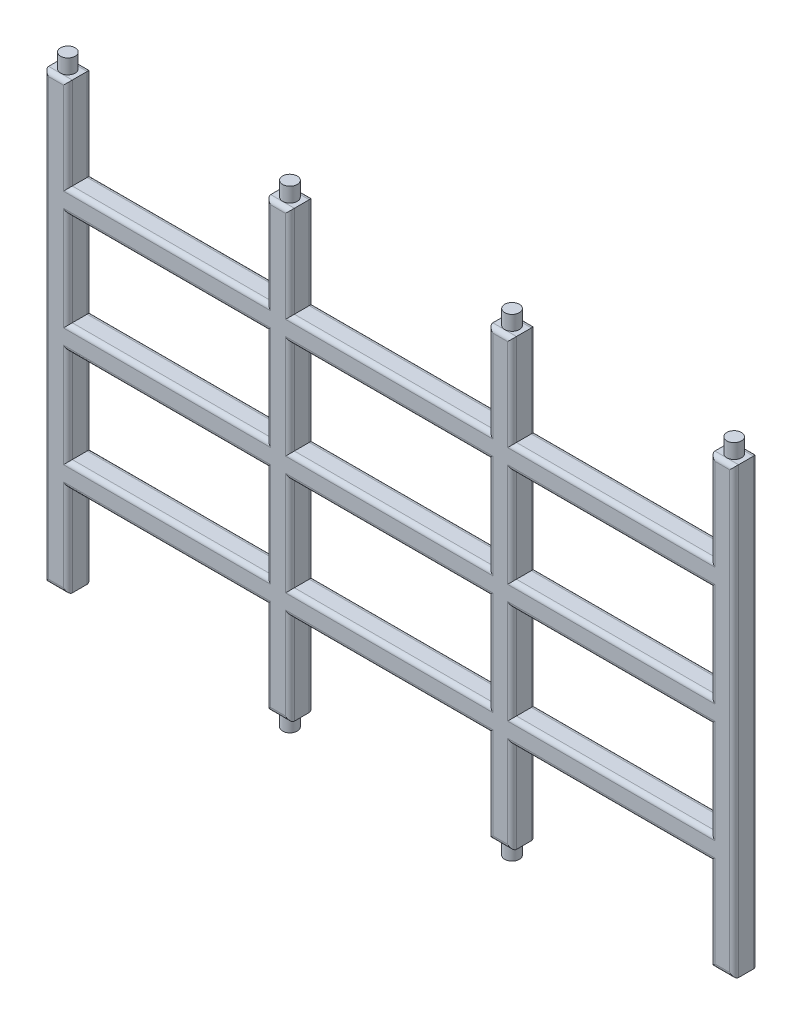
from build123d import *

# Parameters (mm, degrees)
SKETCH_1_W          = 8
SKETCH_1_H          = 31
SKETCH_1_W_2        = 67
SKETCH_1_H_2        = 8
SKETCH_1_H_3        = 32
EXTRUDE_1_DEPTH     = 8
SKETCH_2_R          = 2.475
EXTRUDE_3_DEPTH     = 4.95
EXTRUDE_START       = 4.95
SKETCH_3_R          = 2.475
EXTRUDE_4_DEPTH     = 4.95
SKETCH_4_R          = 2.525
CUT_EXTRUDE_1_DEPTH = 15
FILLET_3_R          = 1.5


with BuildPart() as part:
    # 草图1 → 凸台-拉伸1 (new body)
    with BuildSketch(Plane.XY):
        with Locations((4, 134.5)):
            Rectangle(SKETCH_1_W, SKETCH_1_H)
        with Locations((41.5, 115)):
            Rectangle(SKETCH_1_W_2, SKETCH_1_H_2)
        with Locations((4, 115)):
            Rectangle(SKETCH_1_W, SKETCH_1_H_2)
        with Locations((4, 95)):
            Rectangle(SKETCH_1_W, SKETCH_1_H_3)
        with Locations((41.5, 75)):
            Rectangle(SKETCH_1_W_2, SKETCH_1_H_2)
        with Locations((4, 55)):
            Rectangle(SKETCH_1_W, SKETCH_1_H_3)
        with Locations((4, 75)):
            Rectangle(SKETCH_1_W, SKETCH_1_H_2)
        with Locations((4, 35)):
            Rectangle(SKETCH_1_W, SKETCH_1_H_2)
        with Locations((4, 15.5)):
            Rectangle(SKETCH_1_W, SKETCH_1_H)
        with Locations((41.5, 35)):
            Rectangle(SKETCH_1_W_2, SKETCH_1_H_2)
        with Locations((79, 35)):
            Rectangle(SKETCH_1_W, SKETCH_1_H_2)
        with Locations((79, 15.5)):
            Rectangle(SKETCH_1_W, SKETCH_1_H)
        with Locations((79, 55)):
            Rectangle(SKETCH_1_W, SKETCH_1_H_3)
        with Locations((79, 75)):
            Rectangle(SKETCH_1_W, SKETCH_1_H_2)
        with Locations((79, 95)):
            Rectangle(SKETCH_1_W, SKETCH_1_H_3)
        with Locations((79, 115)):
            Rectangle(SKETCH_1_W, SKETCH_1_H_2)
        with Locations((79, 134.5)):
            Rectangle(SKETCH_1_W, SKETCH_1_H)
        with Locations((116.5, 115)):
            Rectangle(SKETCH_1_W_2, SKETCH_1_H_2)
        with Locations((116.5, 75)):
            Rectangle(SKETCH_1_W_2, SKETCH_1_H_2)
        with Locations((116.5, 35)):
            Rectangle(SKETCH_1_W_2, SKETCH_1_H_2)
        with Locations((154, 15.5)):
            Rectangle(SKETCH_1_W, SKETCH_1_H)
        with Locations((154, 35)):
            Rectangle(SKETCH_1_W, SKETCH_1_H_2)
        with Locations((154, 55)):
            Rectangle(SKETCH_1_W, SKETCH_1_H_3)
        with Locations((154, 75)):
            Rectangle(SKETCH_1_W, SKETCH_1_H_2)
        with Locations((154, 95)):
            Rectangle(SKETCH_1_W, SKETCH_1_H_3)
        with Locations((154, 115)):
            Rectangle(SKETCH_1_W, SKETCH_1_H_2)
        with Locations((154, 134.5)):
            Rectangle(SKETCH_1_W, SKETCH_1_H)
        with Locations((191.5, 115)):
            Rectangle(SKETCH_1_W_2, SKETCH_1_H_2)
        with Locations((191.5, 75)):
            Rectangle(SKETCH_1_W_2, SKETCH_1_H_2)
        with Locations((191.5, 35)):
            Rectangle(SKETCH_1_W_2, SKETCH_1_H_2)
        with Locations((229, 15.5)):
            Rectangle(SKETCH_1_W, SKETCH_1_H)
        with Locations((229, 35)):
            Rectangle(SKETCH_1_W, SKETCH_1_H_2)
        with Locations((229, 55)):
            Rectangle(SKETCH_1_W, SKETCH_1_H_3)
        with Locations((229, 75)):
            Rectangle(SKETCH_1_W, SKETCH_1_H_2)
        with Locations((229, 95)):
            Rectangle(SKETCH_1_W, SKETCH_1_H_3)
        with Locations((229, 115)):
            Rectangle(SKETCH_1_W, SKETCH_1_H_2)
        with Locations((229, 134.5)):
            Rectangle(SKETCH_1_W, SKETCH_1_H)
    extrude(amount=EXTRUDE_1_DEPTH)

    # 草图2 → 凸台-拉伸3 (add)
    with BuildSketch(Plane(origin=(0, 150, 0), x_dir=(1, 0, 0), z_dir=(0, 1, 0))):
        with Locations((4, -4)):
            Circle(SKETCH_2_R)
        with Locations((229, -4)):
            Circle(SKETCH_2_R)
        with Locations((79, -4)):
            Circle(SKETCH_2_R)
        with Locations((154, -4)):
            Circle(SKETCH_2_R)
    extrude(amount=EXTRUDE_3_DEPTH)

    # 草图3 → 凸台-拉伸4 (add)
    with BuildSketch(Plane.XZ.offset(EXTRUDE_START)):
        with Locations((79, 4)):
            Circle(SKETCH_3_R)
        with Locations((154, 4)):
            Circle(SKETCH_3_R)
    extrude(amount=-EXTRUDE_4_DEPTH)

    # 草图4 → 切除-拉伸1 (cut)
    with BuildSketch(Plane.XZ):
        with Locations(Location((4, 4, 0), (0, 0, 270))):
            Circle(SKETCH_4_R)
        with Locations(Location((229, 4, 0), (0, 0, 270))):
            Circle(SKETCH_4_R)
    extrude(amount=-CUT_EXTRUDE_1_DEPTH, mode=Mode.SUBTRACT)

    # 圆角3
    fillet_3_edges = [part.edges().sort_by_distance(p)[0] for p in [
        (4, 150, 8),
        (0, 75, 8),
        (191.5, 31, 8),
        (4, 0, 8),
        (8, 15.5, 8),
        (41.5, 31, 8),
        (75, 15.5, 8),
        (79, 0, 8),
        (83, 15.5, 8),
        (116.5, 31, 8),
        (150, 15.5, 8),
        (154, 0, 8),
        (225, 15.5, 8),
        (158, 15.5, 8),
        (225, 55, 8),
        (191.5, 39, 8),
        (158, 55, 8),
        (191.5, 71, 8),
        (150, 55, 8),
        (116.5, 39, 8),
        (83, 55, 8),
        (116.5, 71, 8),
        (225, 95, 8),
        (229, 0, 8),
        (191.5, 79, 8),
        (158, 95, 8),
        (191.5, 111, 8),
        (75, 55, 8),
        (41.5, 39, 8),
        (8, 55, 8),
        (41.5, 71, 8),
        (150, 95, 8),
        (116.5, 79, 8),
        (83, 95, 8),
        (233, 75, 8),
        (116.5, 111, 8),
        (75, 95, 8),
        (41.5, 79, 8),
        (8, 95, 8),
        (41.5, 111, 8),
        (229, 150, 8),
        (225, 134.5, 8),
        (191.5, 119, 8),
        (158, 134.5, 8),
        (41.5, 111, 0),
        (8, 95, 0),
        (41.5, 79, 0),
        (75, 95, 0),
        (154, 150, 8),
        (116.5, 111, 0),
        (83, 95, 0),
        (116.5, 79, 0),
        (150, 95, 0),
        (41.5, 71, 0),
        (8, 55, 0),
        (41.5, 39, 0),
        (75, 55, 0),
        (191.5, 111, 0),
        (158, 95, 0),
        (150, 134.5, 8),
        (191.5, 79, 0),
        (225, 95, 0),
        (116.5, 71, 0),
        (83, 55, 0),
        (116.5, 39, 0),
        (150, 55, 0),
        (191.5, 71, 0),
        (158, 55, 0),
        (191.5, 39, 0),
        (225, 55, 0),
        (116.5, 119, 8),
        (158, 15.5, 0),
        (154, 0, 0),
        (150, 15.5, 0),
        (116.5, 31, 0),
        (83, 15.5, 0),
        (79, 0, 0),
        (75, 15.5, 0),
        (41.5, 31, 0),
        (8, 15.5, 0),
        (4, 0, 0),
        (83, 134.5, 8),
        (0, 75, 0),
        (4, 150, 0),
        (8, 134.5, 0),
        (41.5, 119, 0),
        (75, 134.5, 0),
        (79, 150, 0),
        (83, 134.5, 0),
        (116.5, 119, 0),
        (79, 150, 8),
        (150, 134.5, 0),
        (154, 150, 0),
        (158, 134.5, 0),
        (191.5, 119, 0),
        (225, 134.5, 0),
        (229, 150, 0),
        (233, 75, 0),
        (229, 0, 0),
        (75, 134.5, 8),
        (225, 15.5, 0),
        (191.5, 31, 0),
        (41.5, 119, 8),
        (8, 134.5, 8),
    ]]
    fillet(fillet_3_edges, radius=FILLET_3_R)


solid = part.part
